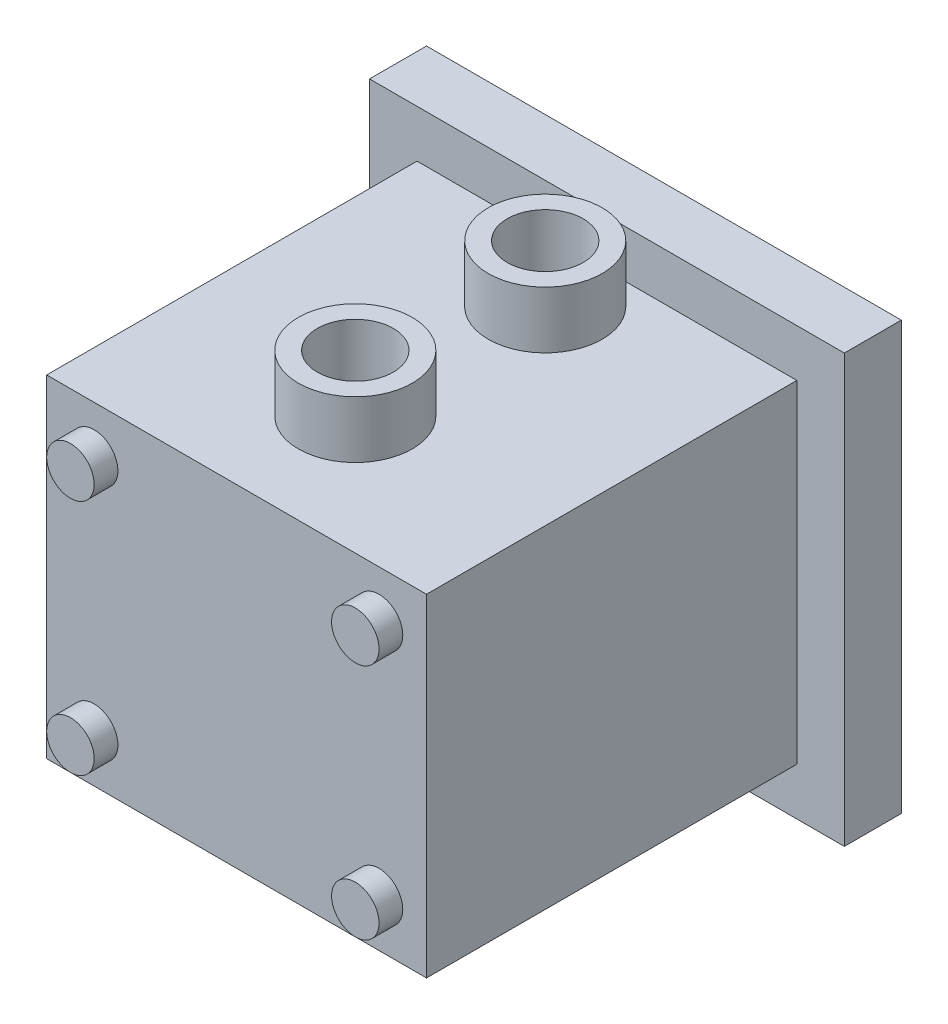
from build123d import *

# Parameters (mm, degrees)
HOUSING_80X70X78_ASSUMED_START            = 12
SKETCH1_W                                 = 80
SKETCH1_H                                 = 70
HOUSING_80X70X78_ASSUMED_DEPTH            = 78
SKETCH2_W                                 = 100
SKETCH2_H                                 = 90
FLANGE_100X90_ASSUMED_DEPTH               = 12
SKETCH3_R                                 = 9.525
SHAFT_D19P05_LISTING_LENGTH_ASSUMED_DEPTH = 30
FASTENER_ENVELOPE_ASSUMED_START           = 90
SKETCH4_R                                 = 5
FASTENER_ENVELOPE_ASSUMED_DEPTH           = 5
BOSS_EXTRUDE5_START                       = 90
SKETCH5_R                                 = 5
BOSS_EXTRUDE5_DEPTH                       = 5
BOSS_EXTRUDE6_START                       = 90
SKETCH6_R                                 = 5
BOSS_EXTRUDE6_DEPTH                       = 5
BOSS_EXTRUDE7_START                       = 90
SKETCH7_R                                 = 5
BOSS_EXTRUDE7_DEPTH                       = 5
INLET_3_8NPT_PORT_LOCATION_ASSUMED_START  = 35
SKETCH8_R                                 = 12
SKETCH8_R_2                               = 8
INLET_3_8NPT_PORT_LOCATION_ASSUMED_DEPTH  = 12
OUTLET_3_8NPT_PORT_LOCATION_ASSUMED_START = 35
SKETCH9_R                                 = 12
SKETCH9_R_2                               = 8
OUTLET_3_8NPT_PORT_LOCATION_ASSUMED_DEPTH = 12


with BuildPart() as part:
    # Sketch1 → Housing_80x70x78_ASSUMED (new body)
    with BuildSketch(Plane.XY.offset(HOUSING_80X70X78_ASSUMED_START)):
        Rectangle(SKETCH1_W, SKETCH1_H)
    extrude(amount=HOUSING_80X70X78_ASSUMED_DEPTH)


with BuildPart() as body_2:
    # Sketch2 → Flange_100x90_ASSUMED (new body)
    with BuildSketch(Plane.XY):
        Rectangle(SKETCH2_W, SKETCH2_H)
    extrude(amount=FLANGE_100X90_ASSUMED_DEPTH)


with BuildPart() as body_3:
    # Sketch3 → Shaft_D19p05_listing_length_ASSUMED (new body)
    with BuildSketch(Plane.XY):
        Circle(SKETCH3_R)
    extrude(amount=-SHAFT_D19P05_LISTING_LENGTH_ASSUMED_DEPTH)


with BuildPart() as body_4:
    # Sketch4 → Fastener_envelope_ASSUMED (new body)
    with BuildSketch(Plane.XY.offset(FASTENER_ENVELOPE_ASSUMED_START)):
        with Locations((-30, -25)):
            Circle(SKETCH4_R)
    extrude(amount=FASTENER_ENVELOPE_ASSUMED_DEPTH)


with BuildPart() as body_5:
    # Sketch5 → Boss-Extrude5 (new body)
    with BuildSketch(Plane.XY.offset(BOSS_EXTRUDE5_START)):
        with Locations((-30, 25)):
            Circle(SKETCH5_R)
    extrude(amount=BOSS_EXTRUDE5_DEPTH)


with BuildPart() as body_6:
    # Sketch6 → Boss-Extrude6 (new body)
    with BuildSketch(Plane.XY.offset(BOSS_EXTRUDE6_START)):
        with Locations((30, -25)):
            Circle(SKETCH6_R)
    extrude(amount=BOSS_EXTRUDE6_DEPTH)


with BuildPart() as body_7:
    # Sketch7 → Boss-Extrude7 (new body)
    with BuildSketch(Plane.XY.offset(BOSS_EXTRUDE7_START)):
        with Locations((30, 25)):
            Circle(SKETCH7_R)
    extrude(amount=BOSS_EXTRUDE7_DEPTH)


with BuildPart() as body_8:
    # Sketch8 → Inlet_3_8NPT_port_location_ASSUMED (new body)
    with BuildSketch(Plane(origin=(0, 0, 0), x_dir=(1, 0, 0), z_dir=(0, 1, 0)).offset(INLET_3_8NPT_PORT_LOCATION_ASSUMED_START)):
        with Locations(Location((0, -25, 0), (0, 0, 270))):
            Circle(SKETCH8_R)
        with Locations(Location((0, -25, 0), (0, 0, 270))):
            Circle(SKETCH8_R_2, mode=Mode.SUBTRACT)
    extrude(amount=INLET_3_8NPT_PORT_LOCATION_ASSUMED_DEPTH)


with BuildPart() as body_9:
    # Sketch9 → Outlet_3_8NPT_port_location_ASSUMED (new body)
    with BuildSketch(Plane(origin=(0, 0, 0), x_dir=(1, 0, 0), z_dir=(0, 1, 0)).offset(OUTLET_3_8NPT_PORT_LOCATION_ASSUMED_START)):
        with Locations(Location((0, -65, 0), (0, 0, 270))):
            Circle(SKETCH9_R)
        with Locations(Location((0, -65, 0), (0, 0, 270))):
            Circle(SKETCH9_R_2, mode=Mode.SUBTRACT)
    extrude(amount=OUTLET_3_8NPT_PORT_LOCATION_ASSUMED_DEPTH)


solid = Compound([part.part, body_2.part, body_3.part, body_4.part, body_5.part, body_6.part, body_7.part, body_8.part, body_9.part])
